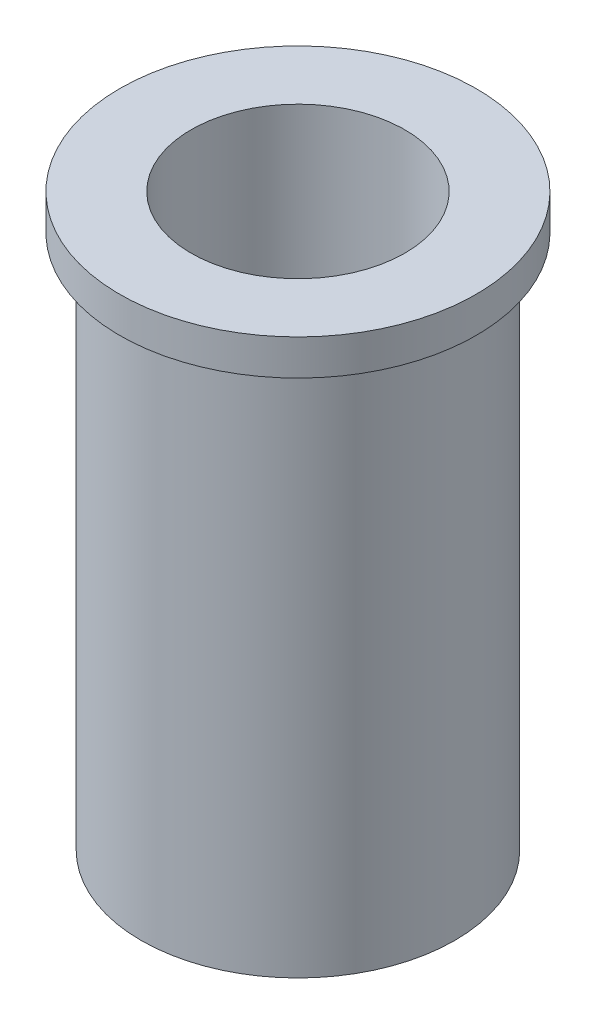
from build123d import *

# Parameters (mm, degrees)
SKETCH4_R           = 3
BOSS_EXTRUDE1_DEPTH = 16
SKETCH5_R           = 3
CUT_EXTRUDE1_DEPTH  = 16


with BuildPart() as part:
    # Sketch2 → Revolve3 (revolve)
    with BuildSketch(Plane.XY):
        Polygon((-5, 2.872057786), (0, 2.872057786), (0, -13.127942214), (-4.4, -13.127942214), (-4.4, 1.872057786), (-5, 1.872057786), align=None)
    revolve(axis=Axis((0, 2.872057786, 0), (0, -1, 0)))

    # Sketch4 → Boss-Extrude1 (add)
    with BuildSketch(Plane.XZ.offset(13.127942214)):
        Circle(SKETCH4_R)
    extrude(amount=-BOSS_EXTRUDE1_DEPTH)

    # Sketch5 → Cut-Extrude1 (cut)
    with BuildSketch(Plane.XZ.offset(13.127942214)):
        Circle(SKETCH5_R)
    extrude(amount=-CUT_EXTRUDE1_DEPTH, mode=Mode.SUBTRACT)


solid = part.part
